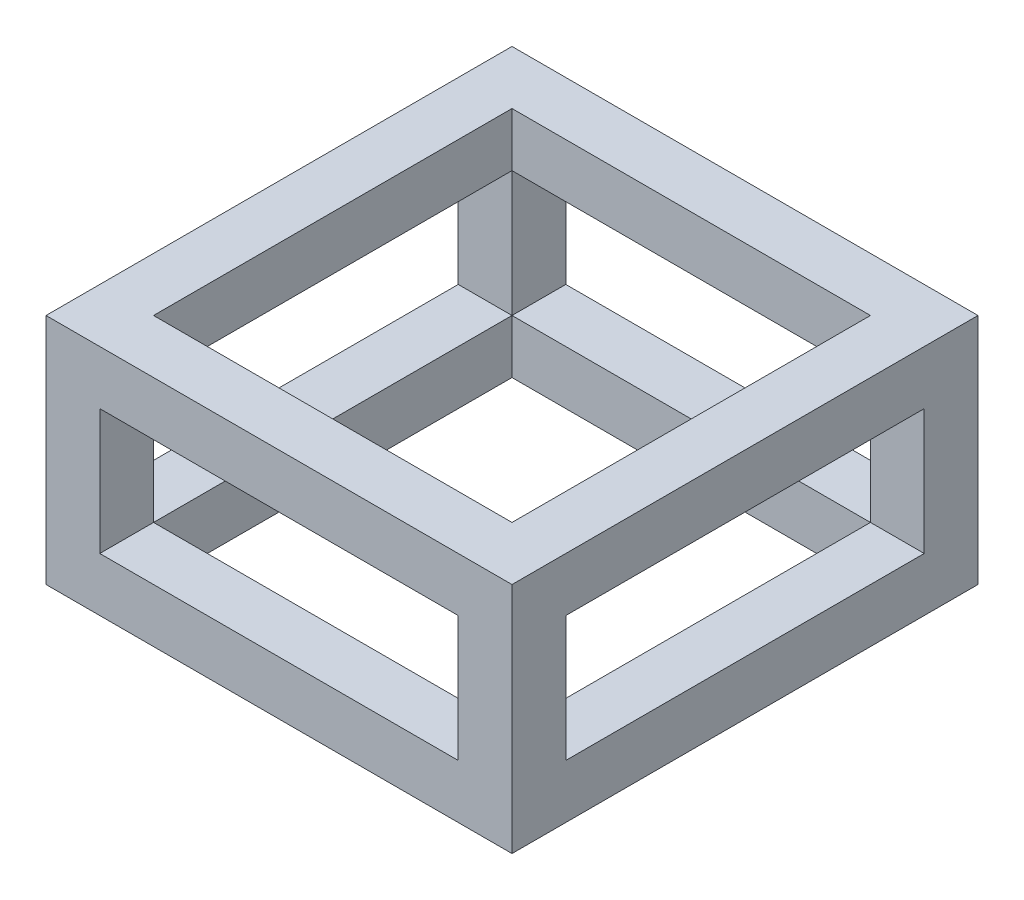
from build123d import *

# Parameters (mm, degrees)
SKETCH1_W           = 130
SKETCH1_H           = 130
SKETCH1_W_2         = 100
SKETCH1_H_2         = 100
BOSS_EXTRUDE1_DEPTH = 15
SKETCH2_W           = 15
SKETCH2_H           = 15
BOSS_EXTRUDE2_DEPTH = 35
SKETCH3_W           = 130
SKETCH3_H           = 130
SKETCH3_W_2         = 100
SKETCH3_H_2         = 100
BOSS_EXTRUDE3_DEPTH = 15


with BuildPart() as part:
    # Sketch1 → Boss-Extrude1 (new body)
    with BuildSketch(Plane(origin=(0, 0, 0), x_dir=(1, 0, 0), z_dir=(0, 1, 0))):
        Rectangle(SKETCH1_W, SKETCH1_H)
        Rectangle(SKETCH1_W_2, SKETCH1_H_2, mode=Mode.SUBTRACT)
    extrude(amount=BOSS_EXTRUDE1_DEPTH)

    # Sketch2 → Boss-Extrude2 (add)
    with BuildSketch(Plane(origin=(0, 15, 0), x_dir=(1, 0, 0), z_dir=(0, 1, 0))):
        with Locations((-57.5, 57.5)):
            Rectangle(SKETCH2_W, SKETCH2_H)
        with Locations((57.5, 57.5)):
            Rectangle(SKETCH2_W, SKETCH2_H)
        with Locations((57.5, -57.5)):
            Rectangle(SKETCH2_W, SKETCH2_H)
        with Locations((-57.5, -57.5)):
            Rectangle(SKETCH2_W, SKETCH2_H)
    extrude(amount=BOSS_EXTRUDE2_DEPTH)

    # Sketch3 → Boss-Extrude3 (add)
    with BuildSketch(Plane(origin=(0, 50, 0), x_dir=(1, 0, 0), z_dir=(0, 1, 0))):
        Rectangle(SKETCH3_W, SKETCH3_H)
        Rectangle(SKETCH3_W_2, SKETCH3_H_2, mode=Mode.SUBTRACT)
    extrude(amount=BOSS_EXTRUDE3_DEPTH)


solid = part.part
